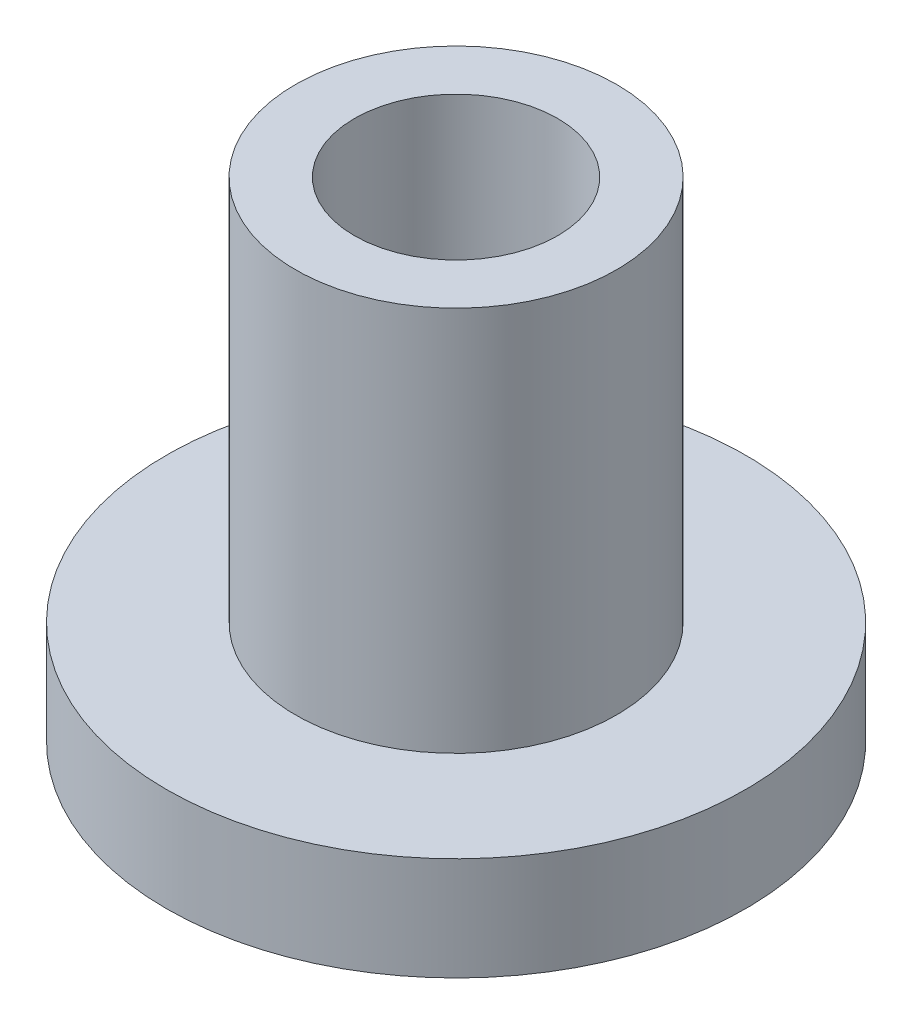
from build123d import *

# Parameters (mm, degrees)
SKETCH1_R        = 7.9
EXTRUSION2_DEPTH = 19.05
EXTRUSION3_REACH = 24.084
SKETCH2_R        = 5
SKETCH3_R        = 14.25
EXTRUSION4_DEPTH = 5.08
EXTRUSION5_REACH = 29.676
SKETCH4_R        = 5


with BuildPart() as part:
    # Sketch1 → Extrusion2 (new body)
    with BuildSketch(Plane(origin=(0, 5, 0), x_dir=(1, 0, 0), z_dir=(0, 1, 0))):
        with Locations(Location((0, 0, 0), (0, 0, 90))):
            Circle(SKETCH1_R)
    extrude(amount=EXTRUSION2_DEPTH)

    # Sketch2 → Extrusion3 (cut, up to next)
    with BuildSketch(Plane(origin=(0, 24.05, 0), x_dir=(-1, 0, 0), z_dir=(0, 1, 0)), mode=Mode.PRIVATE) as extrusion3_sk1:
        with Locations(Location((0, 0, 0), (0, 0, 90))):
            Circle(SKETCH2_R)
    extrusion3_tool1 = extrude(extrusion3_sk1.sketch, amount=-EXTRUSION3_REACH, mode=Mode.PRIVATE) & part.part
    add(extrusion3_tool1.solids().sort_by_distance((0, 24.05, 0))[0], mode=Mode.SUBTRACT)

    # Sketch3 → Extrusion4 (add)
    with BuildSketch(Plane(origin=(0, 0, 0), x_dir=(-1, 0, 0), z_dir=(0, 1, 0))):
        with Locations(Location((0, 0, 0), (0, 0, 90))):
            Circle(SKETCH3_R)
    extrude(amount=EXTRUSION4_DEPTH)

    # Sketch4 → Extrusion5 (cut, up to next)
    with BuildSketch(Plane(origin=(0, 5.08, 0), x_dir=(-1, 0, 0), z_dir=(0, 1, 0)), mode=Mode.PRIVATE) as extrusion5_sk1:
        with Locations(Location((0, 0, 0), (0, 0, 90))):
            Circle(SKETCH4_R)
    extrusion5_tool1 = extrude(extrusion5_sk1.sketch, amount=-EXTRUSION5_REACH, mode=Mode.PRIVATE) & part.part
    add(extrusion5_tool1.solids().sort_by_distance((0, 5.08, 0))[0], mode=Mode.SUBTRACT)


solid = part.part
